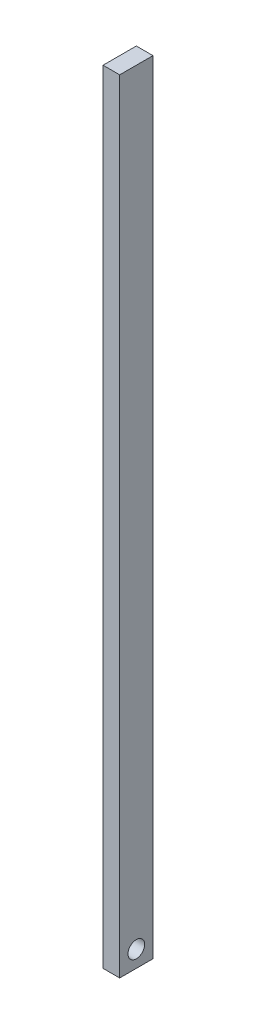
from build123d import *

# Parameters (mm, degrees)
SKETCH1_W           = 25.4
SKETCH1_H           = 50.8
BOSS_EXTRUDE1_DEPTH = 1193.8
SKETCH2_R           = 12.7
CUT_EXTRUDE1_DEPTH  = 1193.8


with BuildPart() as part:
    # Sketch1 → Boss-Extrude1 (new body)
    with BuildSketch(Plane(origin=(0, 0, 0), x_dir=(1, 0, 0), z_dir=(0, 1, 0))):
        with Locations((12.7, 25.4)):
            Rectangle(SKETCH1_W, SKETCH1_H)
    extrude(amount=BOSS_EXTRUDE1_DEPTH)

    # Sketch2 → Cut-Extrude1 (cut)
    with BuildSketch(Plane(origin=(25.4, 0, 0), x_dir=(0, 0, -1), z_dir=(1, 0, 0))):
        with Locations((25.4, 25.4)):
            Circle(SKETCH2_R)
    extrude(amount=-CUT_EXTRUDE1_DEPTH, mode=Mode.SUBTRACT)


solid = part.part
